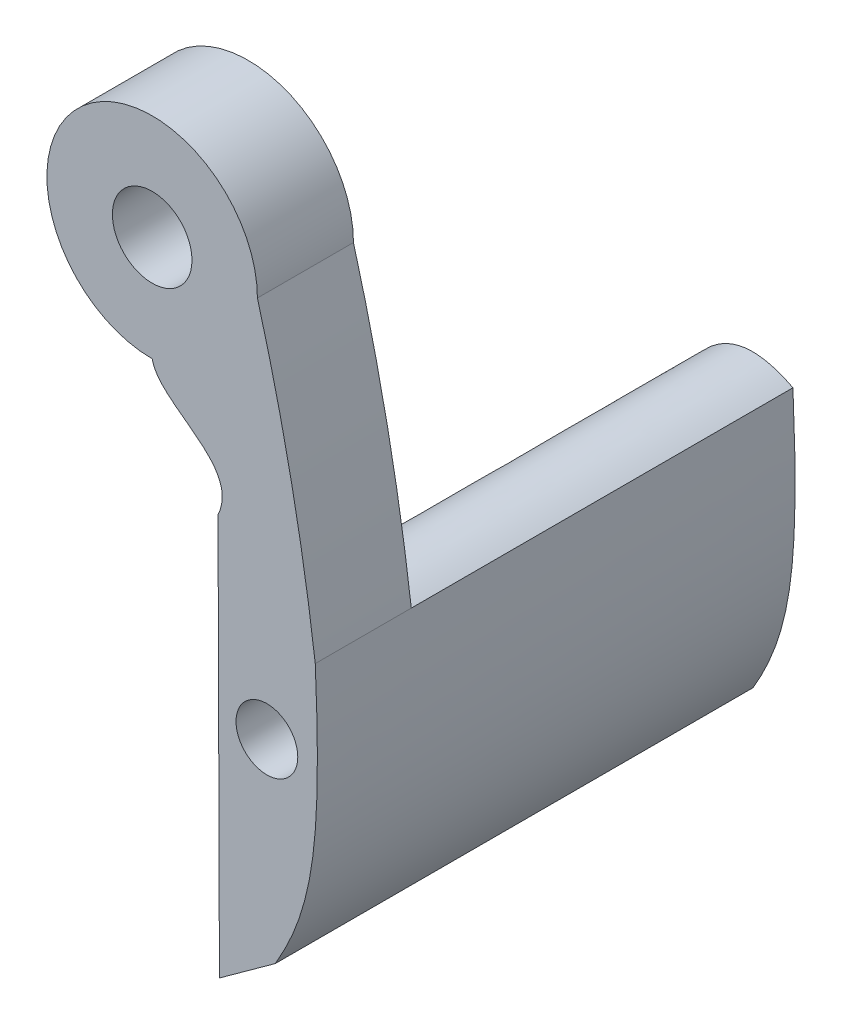
from build123d import *

# Parameters (mm, degrees)
SKETCH1_R           = 2.9
BOSS_EXTRUDE1_DEPTH = 7
BOSS_EXTRUDE2_DEPTH = 27.812432
SKETCH3_R           = 2.25
CUT_EXTRUDE1_DEPTH  = 93.404830354


with BuildPart() as part:
    # Sketch1 → Boss-Extrude1 (new body)
    with BuildSketch(Plane.XY):
        with BuildLine():
            Line((23.684222564, -79.854061858), (27.751665024, -76.911614194))
            add(Edge.make_bspline(
                [(27.751665024, -76.911614194), (30.665612651, -71.996437575), (31.13217948, -67.256532156), (30.668059578, -56.517089881)],
                knots=[0.222415535, 0.222415535, 0.222415535, 0.222415535, 0.766682965, 0.766682965, 0.766682965, 0.766682965], degree=3))
            add(Edge.make_bspline(
                [(30.668059578, -56.517089881), (29.320428981, -45.88374403), (26.453494832, -35.554786486)],
                knots=[0, 0, 0, 1, 1, 1], degree=2))
            ThreePointArc((26.453494832, -35.554786486), (13.359197662, -30.130951008), (18.783033139, -43.225248178))
            add(Edge.make_bspline(
                [(18.783033139, -43.225248178), (19.322772584, -45.817228322), (25.294082339, -46.94058971), (23.583083134, -50.662102957)],
                knots=[0, 0, 0, 0, 1, 1, 1, 1], degree=3))
            Line((23.583083134, -50.662102957), (23.608661583, -58.04483203))
            Line((23.608661583, -58.04483203), (23.684222564, -79.854061858))
        make_face()
        with Locations((18.783033139, -35.554786486)):
            Circle(SKETCH1_R, mode=Mode.SUBTRACT)
    extrude(amount=-BOSS_EXTRUDE1_DEPTH)

    # Sketch2 → Boss-Extrude2 (add)
    with BuildSketch(Plane(origin=(0, 0, -7), x_dir=(-1, 0, 0), z_dir=(0, 0, -1))):
        with BuildLine():
            Line((-27.751665024, -76.911614194), (-23.684222564, -79.854061858))
            Line((-23.684222564, -79.854061858), (-23.608661583, -58.04483203))
            add(Edge.make_bspline(
                [(-23.608661583, -58.04483203), (-26.446360253, -54.336432943), (-30.668059578, -56.51708988)],
                knots=[0, 0, 0, 1, 1, 1], degree=2))
            add(Edge.make_bspline(
                [(-30.668059578, -56.51708988), (-31.132179479, -67.256532155), (-30.665612651, -71.996437575), (-27.751665024, -76.911614194)],
                knots=[0.222415535, 0.222415535, 0.222415535, 0.222415535, 0.766682965, 0.766682965, 0.766682965, 0.766682965], degree=3))
        make_face()
    extrude(amount=BOSS_EXTRUDE2_DEPTH)

    # Sketch3 → Cut-Extrude1 (cut, through all)
    with BuildSketch(Plane.XY):
        with Locations((27.143723241, -63.055671712)):
            Circle(SKETCH3_R)
    extrude(amount=-CUT_EXTRUDE1_DEPTH, mode=Mode.SUBTRACT)


solid = part.part
